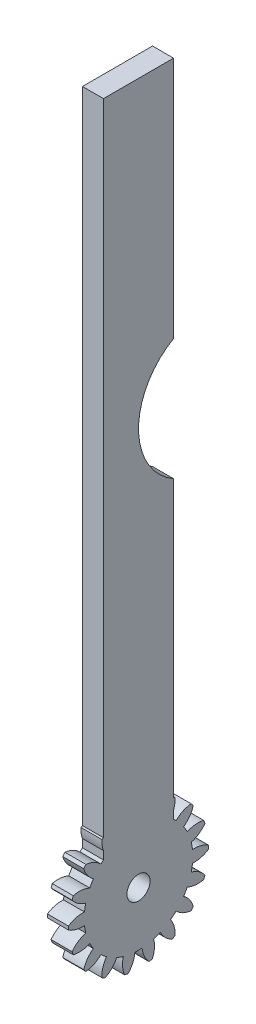
from build123d import *

# Parameters (mm, degrees)
BASPROSKE_W         = 3
BASPROSKE_H         = 10
TOOTHCUT_DEPTH      = 15.456832295
TEETHCUTS_COUNT     = 18
TEETHCUTS_ANGLE     = 340
BORSKE_R            = 0.5
BORE_DEPTH          = 50.0000508
SKETCH7_W           = 10
SKETCH7_H           = 100
BOSS_EXTRUDE5_DEPTH = 3
CUT_EXTRUDE1_DEPTH  = 3
SKETCH11_R          = 1.65
CUT_EXTRUDE2_DEPTH  = 3


with BuildPart() as part:
    # BasProSke → Base-Revolve (revolve)
    with BuildSketch(Plane(origin=(0, 0, 0), x_dir=(1, 0, 0), z_dir=(0, 1, 0)), mode=Mode.PRIVATE) as base_revolve_sk:
        with Locations((1.5, 5)):
            Rectangle(BASPROSKE_W, BASPROSKE_H)
    revolve(base_revolve_sk.sketch.rotate(Axis((-10, 0, 0), (1, 0, 0)), 180), axis=Axis((-10, 0, 0), (1, 0, 0)))

    # TooCutSke → ToothCut (cut, through all)
    with BuildSketch(Plane(origin=(0, 0, 0), x_dir=(0, 0, -1), z_dir=(1, 0, 0))):
        with BuildLine():
            ThreePointArc((0.510641536, 7.732156635), (0, 7.749), (-0.510641536, 7.732156635))
            ThreePointArc((-0.510641536, 7.732156635), (-0.82619259, 8.907320741), (-1.515208602, 9.910236529))
            ThreePointArc((-1.515208602, 9.910236529), (0, 10.0254), (1.515208602, 9.910236529))
            ThreePointArc((1.515208602, 9.910236529), (0.82619259, 8.907320741), (0.510641536, 7.732156635))
        make_face()
    toothcut = extrude(amount=TOOTHCUT_DEPTH, mode=Mode.SUBTRACT)

    # TeethCuts: ToothCut ×18 about axis
    teethcuts_axis = Axis((-10, 0, 0), (1, 0, 0))
    for i in range(1, TEETHCUTS_COUNT):
        add(toothcut.rotate(teethcuts_axis, i * TEETHCUTS_ANGLE / (TEETHCUTS_COUNT - 1)), mode=Mode.SUBTRACT)

    # BorSke → Bore (cut, symmetric)
    with BuildSketch(Plane(origin=(0, 0, 0), x_dir=(0, 0, -1), z_dir=(1, 0, 0))):
        with Locations(Location((0, 0, 0), (0, 0, 180))):
            Circle(BORSKE_R)
    extrude(amount=BORE_DEPTH, both=True, mode=Mode.SUBTRACT)

    # Sketch7 → Boss-Extrude5 (add)
    with BuildSketch(Plane(origin=(3, 0, 0), x_dir=(0, 0, -1), z_dir=(1, 0, 0))):
        with Locations((0, 50)):
            Rectangle(SKETCH7_W, SKETCH7_H)
    extrude(amount=-BOSS_EXTRUDE5_DEPTH)

    # Sketch10 → Cut-Extrude1 (cut)
    with BuildSketch(Plane(origin=(3, 0, 0), x_dir=(0, 0, -1), z_dir=(1, 0, 0))):
        with BuildLine():
            Line((10, 66.692651512), (10, 46.692651512))
            ThreePointArc((10, 46.692651512), (0, 56.692651512), (10, 66.692651512))
        make_face()
    extrude(amount=-CUT_EXTRUDE1_DEPTH, mode=Mode.SUBTRACT)

    # Sketch11 → Cut-Extrude2 (cut)
    with BuildSketch(Plane.ZY):
        Circle(SKETCH11_R)
    extrude(amount=-CUT_EXTRUDE2_DEPTH, mode=Mode.SUBTRACT)


solid = part.part
